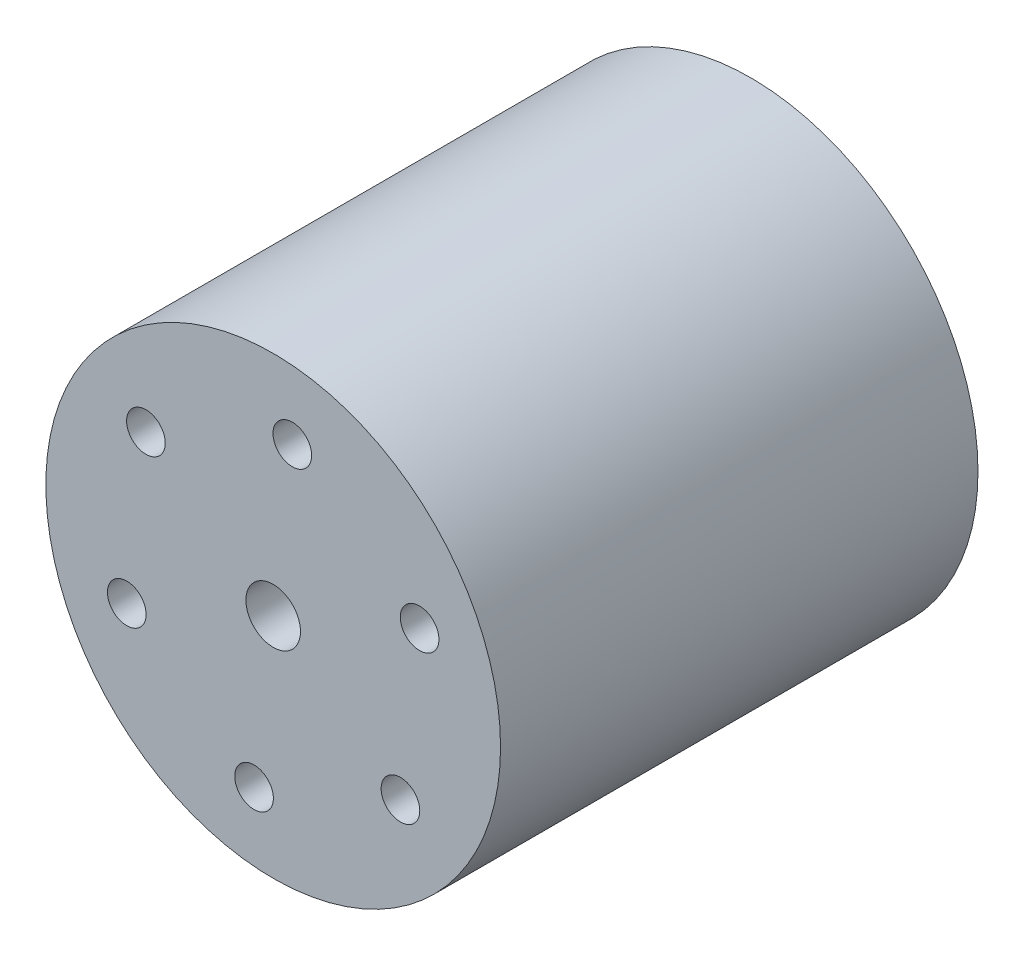
from build123d import *

# Parameters (mm, degrees)
SKETCH1_R           = 50
SKETCH1_R_2         = 4.25
SKETCH1_R_3         = 6
BOSS_EXTRUDE1_DEPTH = 105
SKETCH2_R           = 6
BOSS_EXTRUDE2_DEPTH = 25.4


with BuildPart() as part:
    # Sketch1 → Boss-Extrude1 (new body)
    with BuildSketch(Plane.XY):
        Circle(SKETCH1_R)
        with Locations((-27.985970979, 21.018692356)):
            Circle(SKETCH1_R_2, mode=Mode.SUBTRACT)
        with Locations((4.209736046, 34.745907995)):
            Circle(SKETCH1_R_2, mode=Mode.SUBTRACT)
        with Locations((32.195707024, 13.727215639)):
            Circle(SKETCH1_R_2, mode=Mode.SUBTRACT)
        with Locations((27.985970979, -21.018692356)):
            Circle(SKETCH1_R_2, mode=Mode.SUBTRACT)
        with Locations((-4.209736046, -34.745907995)):
            Circle(SKETCH1_R_2, mode=Mode.SUBTRACT)
        with Locations((-32.195707024, -13.727215639)):
            Circle(SKETCH1_R_2, mode=Mode.SUBTRACT)
        Circle(SKETCH1_R_3, mode=Mode.SUBTRACT)
    extrude(amount=BOSS_EXTRUDE1_DEPTH)


with BuildPart() as body_2:
    # Sketch2 → Boss-Extrude2 (new body)
    with BuildSketch(Plane(origin=(0, 0, 0), x_dir=(-1, 0, 0), z_dir=(0, 0, -1))):
        Circle(SKETCH2_R)
    extrude(amount=BOSS_EXTRUDE2_DEPTH)


solid = Compound([part.part, body_2.part])
